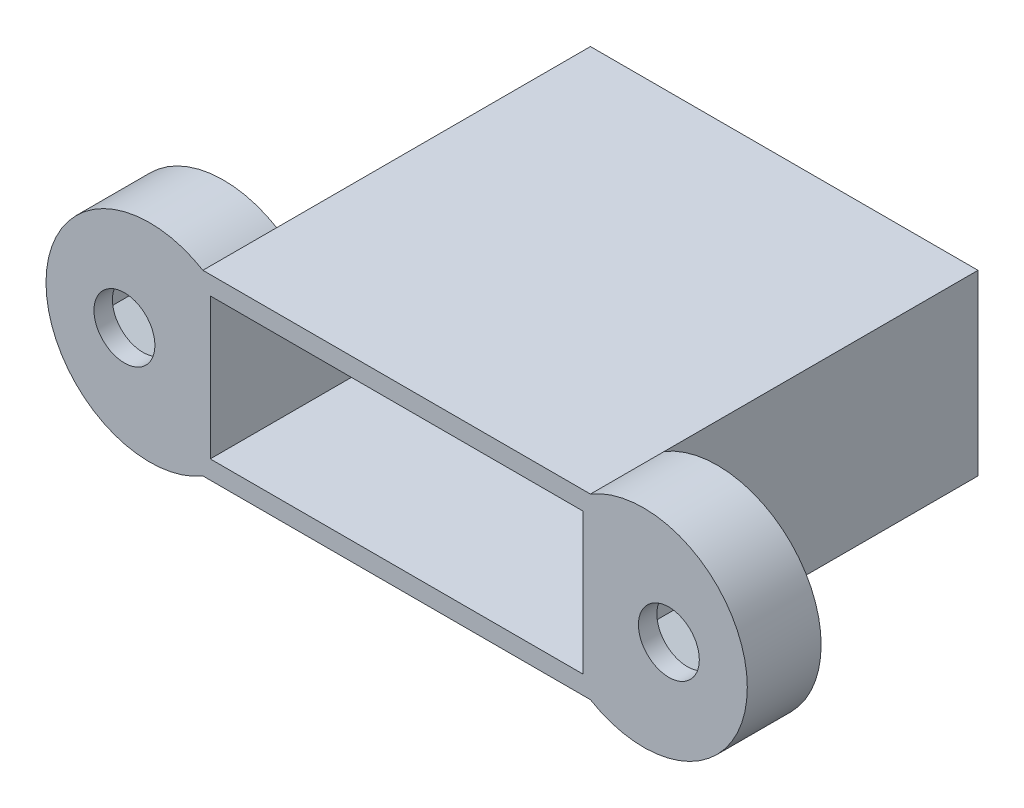
from build123d import *

# Parameters (mm, degrees)
SKETCH1_W           = 21
SKETCH1_H           = 9.65
BOSS_EXTRUDE1_DEPTH = 21
SKETCH3_W           = 20.2
SKETCH3_H           = 7.65
CUT_EXTRUDE1_DEPTH  = 19.6
CUT_EXTRUDE2_DEPTH  = 19.6
BOSS_EXTRUDE2_DEPTH = 4
CUT_EXTRUDE3_DEPTH  = 3
SKETCH22_R          = 1.65
CUT_EXTRUDE4_DEPTH  = 3
BOSS_EXTRUDE3_DEPTH = 4
CUT_EXTRUDE5_DEPTH  = 3
SKETCH25_R          = 1.65
CUT_EXTRUDE6_DEPTH  = 3


with BuildPart() as part:
    # Sketch1 → Boss-Extrude1 (new body)
    with BuildSketch(Plane.XY):
        with Locations((0.42161215, 0.10146028)):
            Rectangle(SKETCH1_W, SKETCH1_H)
    extrude(amount=BOSS_EXTRUDE1_DEPTH)

    # Sketch3 → Cut-Extrude1 (cut)
    with BuildSketch(Plane.XY.offset(21)):
        with Locations((0.42161215, 0.10146028)):
            Rectangle(SKETCH3_W, SKETCH3_H)
    extrude(amount=-CUT_EXTRUDE1_DEPTH, mode=Mode.SUBTRACT)

    # Sketch5 → Cut-Extrude2 (cut)
    with BuildSketch(Plane.XY.offset(1.4)):
        with BuildLine():
            Line((-0.82838785, 3.92646028), (1.67161215, 3.92646028))
            ThreePointArc((1.67161215, 3.92646028), (3.67161215, 1.92646028), (1.67161215, -0.07353972))
            Line((1.67161215, -0.07353972), (-0.82838785, -0.07353972))
            ThreePointArc((-0.82838785, -0.07353972), (-2.82838785, 1.92646028), (-0.82838785, 3.92646028))
        make_face()
    extrude(amount=-CUT_EXTRUDE2_DEPTH, mode=Mode.SUBTRACT)

    # Sketch20 → Boss-Extrude2 (add)
    with BuildSketch(Plane.XY.offset(21)):
        with BuildLine():
            Line((-10.07838785, -4.72353972), (-10.07838785, 4.92646028))
            ThreePointArc((-10.07838785, 4.92646028), (-18.57838785, 0.10146028), (-10.07838785, -4.72353972))
        make_face()
    extrude(amount=-BOSS_EXTRUDE2_DEPTH)

    # Sketch21 → Cut-Extrude3 (cut)
    with BuildSketch(Plane(origin=(0, 0, 17), x_dir=(-1, 0, 0), z_dir=(0, 0, -1))):
        Polygon((14.32838785, 3.85146028), (11.080792586, 1.97646028), (11.080792586, -1.77353972), (14.32838785, -3.64853972), (17.575983115, -1.77353972), (17.575983115, 1.97646028), align=None)
    extrude(amount=-CUT_EXTRUDE3_DEPTH, mode=Mode.SUBTRACT)

    # Sketch22 → Cut-Extrude4 (cut)
    with BuildSketch(Plane(origin=(0, 0, 20), x_dir=(-1, 0, 0), z_dir=(0, 0, -1))):
        with Locations((14.32838785, 0.10146028)):
            Circle(SKETCH22_R)
    extrude(amount=-CUT_EXTRUDE4_DEPTH, mode=Mode.SUBTRACT)

    # Sketch23 → Boss-Extrude3 (add)
    with BuildSketch(Plane.XY.offset(21)):
        with BuildLine():
            Line((10.92161215, 4.92646028), (10.92161215, -4.72353972))
            ThreePointArc((10.92161215, -4.72353972), (19.42161215, 0.10146028), (10.92161215, 4.92646028))
        make_face()
    extrude(amount=-BOSS_EXTRUDE3_DEPTH)

    # Sketch24 → Cut-Extrude5 (cut)
    with BuildSketch(Plane(origin=(0, 0, 17), x_dir=(-1, 0, 0), z_dir=(0, 0, -1))):
        Polygon((-15.17161215, 3.85146028), (-18.419207414, 1.97646028), (-18.419207414, -1.77353972), (-15.17161215, -3.64853972), (-11.924016885, -1.77353972), (-11.924016885, 1.97646028), align=None)
    extrude(amount=-CUT_EXTRUDE5_DEPTH, mode=Mode.SUBTRACT)

    # Sketch25 → Cut-Extrude6 (cut)
    with BuildSketch(Plane(origin=(0, 0, 20), x_dir=(-1, 0, 0), z_dir=(0, 0, -1))):
        with Locations((-15.17161215, 0.10146028)):
            Circle(SKETCH25_R)
    extrude(amount=-CUT_EXTRUDE6_DEPTH, mode=Mode.SUBTRACT)


solid = part.part
